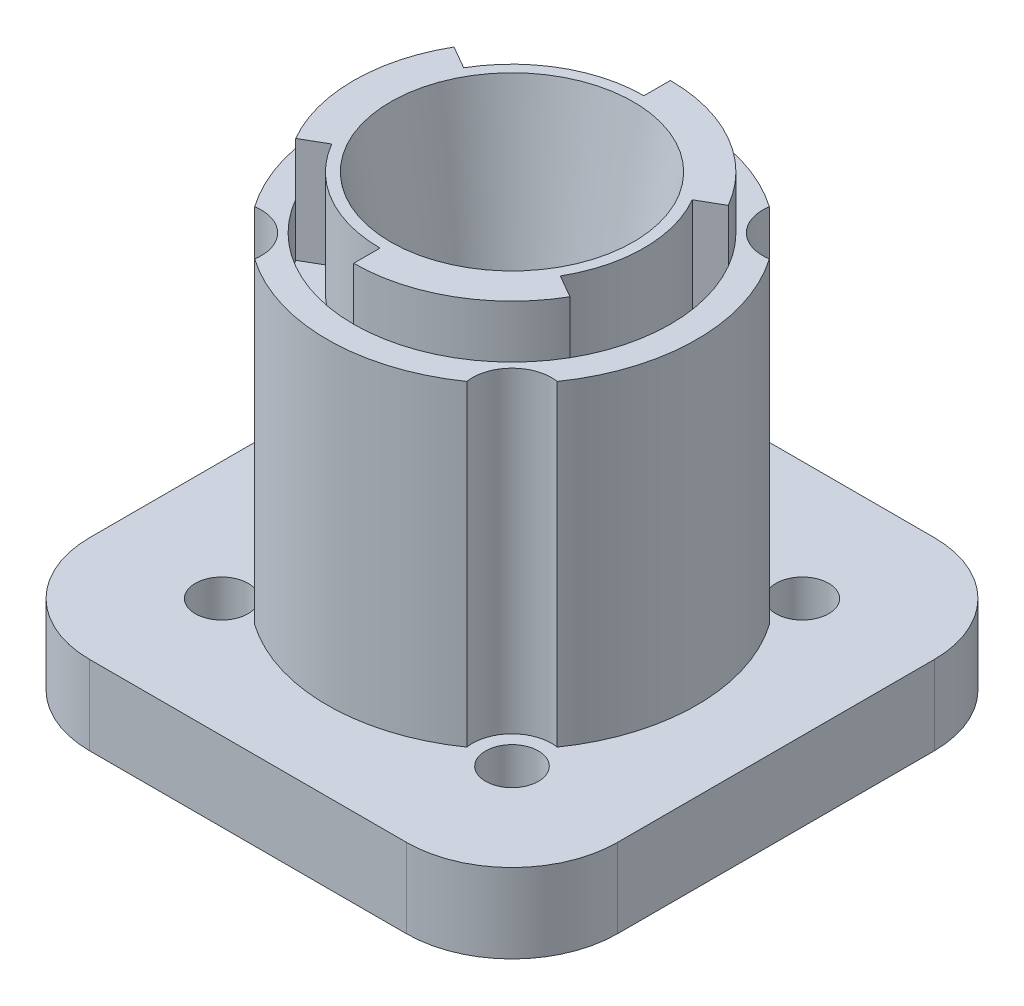
from build123d import *
from build123d.topology import SkipClean

# Parameters (mm, degrees)
CROQUIS1_W              = 50
CROQUIS1_H              = 50
SALIENTE_EXTRUIR1_DEPTH = 7.5
SKETCH4_R               = 12.5
BOSS_EXTRUDE2_DEPTH     = 30
CUT_EXTRUDE1_REACH      = 78.811
SKETCH6_R               = 3.75
SKETCH6_R_2             = 2.5
BOSS_EXTRUDE4_DEPTH     = 7.5
BOSS_EXTRUDE5_DEPTH     = 5
CUT_EXTRUDE3_START      = -5
CUT_EXTRUDE3_DEPTH      = 5
FILLET1_R               = 10
CUT_EXTRUDE4_REACH      = 80.899
SKETCH10_R              = 0.5


with BuildPart() as part:
    # Croquis1 → Saliente-Extruir1 (new body)
    with BuildSketch(Plane(origin=(0, 0, 0), x_dir=(1, 0, 0), z_dir=(0, 1, 0))):
        with Locations((-25, -25)):
            Rectangle(CROQUIS1_W, CROQUIS1_H)
    extrude(amount=SALIENTE_EXTRUIR1_DEPTH)

    # Sketch4 → Boss-Extrude2 (add)
    with BuildSketch(Plane(origin=(0, 7.5, 0), x_dir=(1, 0, 0), z_dir=(0, 1, 0))):
        with BuildLine():
            ThreePointArc((-39.329892063, -14.954892063), (-42.5, -25), (-39.329892063, -35.045107937))
            ThreePointArc((-39.329892063, -35.045107937), (-36.098349571, -36.098349571), (-35.045107937, -39.329892063))
            ThreePointArc((-35.045107937, -39.329892063), (-25, -42.5), (-14.954892063, -39.329892063))
            ThreePointArc((-14.954892063, -39.329892063), (-13.901650429, -36.098349571), (-10.670107937, -35.045107937))
            ThreePointArc((-10.670107937, -35.045107937), (-7.5, -25), (-10.670107937, -14.954892063))
            ThreePointArc((-10.670107937, -14.954892063), (-13.901650429, -13.901650429), (-14.954892063, -10.670107937))
            ThreePointArc((-14.954892063, -10.670107937), (-25, -7.5), (-35.045107937, -10.670107937))
            ThreePointArc((-35.045107937, -10.670107937), (-36.098349571, -13.901650429), (-39.329892063, -14.954892063))
        make_face()
        with Locations(Location((-25, -25, 0), (0, 0, 270))):
            Circle(SKETCH4_R, mode=Mode.SUBTRACT)
    extrude(amount=BOSS_EXTRUDE2_DEPTH)

    # Sketch5 → Cut-Extrude1 (cut, up to next)
    with BuildSketch(Plane(origin=(0, 7.5, 0), x_dir=(1, 0, 0), z_dir=(0, 1, 0)), mode=Mode.PRIVATE) as cut_extrude1_sk1:
        with BuildLine():
            ThreePointArc((-35.045107937, -10.670107937), (-41.401650429, -8.598349571), (-39.329892063, -14.954892063))
            ThreePointArc((-39.329892063, -14.954892063), (-36.311977772, -14.099306515), (-35, -11.25))
            ThreePointArc((-35, -11.25), (-35.011293992, -10.959178091), (-35.045107937, -10.670107937))
        make_face()
    cut_extrude1_tool1 = extrude(cut_extrude1_sk1.sketch, amount=-CUT_EXTRUDE1_REACH, mode=Mode.PRIVATE) & part.part
    # Sketch5 → Cut-Extrude1 (cut, up to next)
    with BuildSketch(Plane(origin=(0, 7.5, 0), x_dir=(1, 0, 0), z_dir=(0, 1, 0)), mode=Mode.PRIVATE) as cut_extrude1_sk2:
        with BuildLine():
            ThreePointArc((-7.5, -11.25), (-10.959178091, -7.511293992), (-14.954892063, -10.670107937))
            ThreePointArc((-14.954892063, -10.670107937), (-13.901650429, -13.901650429), (-10.670107937, -14.954892063))
            ThreePointArc((-10.670107937, -14.954892063), (-8.400693485, -13.688022228), (-7.5, -11.25))
        make_face()
    cut_extrude1_tool2 = extrude(cut_extrude1_sk2.sketch, amount=-CUT_EXTRUDE1_REACH, mode=Mode.PRIVATE) & part.part
    # Sketch5 → Cut-Extrude1 (cut, up to next)
    with BuildSketch(Plane(origin=(0, 7.5, 0), x_dir=(1, 0, 0), z_dir=(0, 1, 0)), mode=Mode.PRIVATE) as cut_extrude1_sk3:
        with BuildLine():
            ThreePointArc((-7.5, -38.75), (-8.400693485, -36.311977772), (-10.670107937, -35.045107937))
            ThreePointArc((-10.670107937, -35.045107937), (-13.901650429, -36.098349571), (-14.954892063, -39.329892063))
            ThreePointArc((-14.954892063, -39.329892063), (-10.959178091, -42.488706008), (-7.5, -38.75))
        make_face()
    cut_extrude1_tool3 = extrude(cut_extrude1_sk3.sketch, amount=-CUT_EXTRUDE1_REACH, mode=Mode.PRIVATE) & part.part
    # Sketch5 → Cut-Extrude1 (cut, up to next)
    with BuildSketch(Plane(origin=(0, 7.5, 0), x_dir=(1, 0, 0), z_dir=(0, 1, 0)), mode=Mode.PRIVATE) as cut_extrude1_sk4:
        with BuildLine():
            ThreePointArc((-39.329892063, -35.045107937), (-41.401650429, -41.401650429), (-35.045107937, -39.329892063))
            ThreePointArc((-35.045107937, -39.329892063), (-35.011293992, -39.040821909), (-35, -38.75))
            ThreePointArc((-35, -38.75), (-36.311977772, -35.900693485), (-39.329892063, -35.045107937))
        make_face()
    cut_extrude1_tool4 = extrude(cut_extrude1_sk4.sketch, amount=-CUT_EXTRUDE1_REACH, mode=Mode.PRIVATE) & part.part
    add(cut_extrude1_tool1.solids().sort_by_distance((-38.75, 7.5, 11.25))[0], mode=Mode.SUBTRACT)
    add(cut_extrude1_tool2.solids().sort_by_distance((-11.25, 7.5, 11.25))[0], mode=Mode.SUBTRACT)
    add(cut_extrude1_tool3.solids().sort_by_distance((-11.25, 7.5, 38.75))[0], mode=Mode.SUBTRACT)
    add(cut_extrude1_tool4.solids().sort_by_distance((-38.75, 7.5, 38.75))[0], mode=Mode.SUBTRACT)

    # Sketch6 → Boss-Extrude4 (add)
    # profile 1 of 4: a face of its own
    with BuildSketch(Plane.XZ):
        with Locations((-11.25, 38.75)):
            Circle(SKETCH6_R)
        with Locations(Location((-11.25, 38.75, 0), (0, 0, 90))):
            Circle(SKETCH6_R_2, mode=Mode.SUBTRACT)
    # profile 2 of 4: a face of its own
    with BuildSketch(Plane.XZ):
        with Locations((-38.75, 38.75)):
            Circle(SKETCH6_R)
        with Locations(Location((-38.75, 38.75, 0), (0, 0, 270))):
            Circle(SKETCH6_R_2, mode=Mode.SUBTRACT)
    # profile 3 of 4: a face of its own
    with BuildSketch(Plane.XZ):
        with Locations((-38.75, 11.25)):
            Circle(SKETCH6_R)
        with Locations(Location((-38.75, 11.25, 0), (0, 0, 270))):
            Circle(SKETCH6_R_2, mode=Mode.SUBTRACT)
    # profile 4 of 4: a face of its own
    with BuildSketch(Plane.XZ):
        with Locations((-11.25, 11.25)):
            Circle(SKETCH6_R)
        with Locations(Location((-11.25, 11.25, 0), (0, 0, 90))):
            Circle(SKETCH6_R_2, mode=Mode.SUBTRACT)
    extrude(amount=-BOSS_EXTRUDE4_DEPTH)

    # Sketch9 → Boss-Extrude5 (add)
    with BuildSketch(Plane(origin=(0, 37.5, 0), x_dir=(1, 0, 0), z_dir=(0, 1, 0))):
        with BuildLine():
            Line((-35.825317547, -18.75), (-37.990381057, -17.5))
            ThreePointArc((-37.990381057, -17.5), (-40, -25), (-37.990381057, -32.5))
            Line((-37.990381057, -32.5), (-35.825317547, -31.25))
            ThreePointArc((-35.825317547, -31.25), (-37.5, -25), (-35.825317547, -18.75))
        make_face()
        with BuildLine():
            Line((-25, -12.5), (-25, -10))
            ThreePointArc((-25, -10), (-17.5, -12.009618943), (-12.009618943, -17.5))
            Line((-12.009618943, -17.5), (-14.174682453, -18.75))
            ThreePointArc((-14.174682453, -18.75), (-18.75, -14.174682453), (-25, -12.5))
        make_face()
        with BuildLine():
            Line((-14.174682453, -31.25), (-12.009618943, -32.5))
            ThreePointArc((-12.009618943, -32.5), (-17.5, -37.990381057), (-25, -40))
            Line((-25, -40), (-25, -37.5))
            ThreePointArc((-25, -37.5), (-18.75, -35.825317547), (-14.174682453, -31.25))
        make_face()
    extrude(amount=BOSS_EXTRUDE5_DEPTH)

    # Sketch7 → Cut-Extrude3 (cut)
    with BuildSketch(Plane(origin=(0, 37.5, 0), x_dir=(1, 0, 0), z_dir=(0, 1, 0)).offset(CUT_EXTRUDE3_START)):
        with BuildLine():
            Line((-35.825317547, -18.75), (-37.990381057, -17.5))
            ThreePointArc((-37.990381057, -17.5), (-32.5, -12.009618943), (-25, -10))
            Line((-25, -10), (-25, -12.5))
            ThreePointArc((-25, -12.5), (-31.25, -14.174682453), (-35.825317547, -18.75))
        make_face()
        with BuildLine():
            Line((-14.174682453, -18.75), (-12.009618943, -17.5))
            ThreePointArc((-12.009618943, -17.5), (-10, -25), (-12.009618943, -32.5))
            Line((-12.009618943, -32.5), (-14.174682453, -31.25))
            ThreePointArc((-14.174682453, -31.25), (-12.5, -25), (-14.174682453, -18.75))
        make_face()
        with BuildLine():
            Line((-25, -37.5), (-25, -40))
            ThreePointArc((-25, -40), (-32.5, -37.990381057), (-37.990381057, -32.5))
            Line((-37.990381057, -32.5), (-35.825317547, -31.25))
            ThreePointArc((-35.825317547, -31.25), (-31.25, -35.825317547), (-25, -37.5))
        make_face()
    extrude(amount=CUT_EXTRUDE3_DEPTH, mode=Mode.SUBTRACT)

    # Fillet1
    fillet1_edges = [part.edges().sort_by_distance(p)[0] for p in [
        (0, 3.75, 50),
        (-50, 3.75, 50),
        (-50, 3.75, 0),
        (0, 3.75, 0),
    ]]
    fillet(fillet1_edges, radius=FILLET1_R)

    # Sketch10 → Cut-Extrude4 (cut, up to next)
    with BuildSketch(Plane(origin=(0, 7.5, 0), x_dir=(1, 0, 0), z_dir=(0, 1, 0)), mode=Mode.PRIVATE) as cut_extrude4_sk1:
        with Locations(Location((-25, -21.5, 0), (0, 0, 270))):
            Circle(SKETCH10_R)
    cut_extrude4_tool1 = extrude(cut_extrude4_sk1.sketch, amount=-CUT_EXTRUDE4_REACH, mode=Mode.PRIVATE) & part.part
    # Sketch10 → Cut-Extrude4 (cut, up to next)
    with BuildSketch(Plane(origin=(0, 7.5, 0), x_dir=(1, 0, 0), z_dir=(0, 1, 0)), mode=Mode.PRIVATE) as cut_extrude4_sk2:
        with Locations(Location((-25, -28.5, 0), (0, 0, 270))):
            Circle(SKETCH10_R)
    cut_extrude4_tool2 = extrude(cut_extrude4_sk2.sketch, amount=-CUT_EXTRUDE4_REACH, mode=Mode.PRIVATE) & part.part
    add(cut_extrude4_tool1.solids().sort_by_distance((-25, 7.5, 21.5))[0], mode=Mode.SUBTRACT)
    add(cut_extrude4_tool2.solids().sort_by_distance((-25, 7.5, 28.5))[0], mode=Mode.SUBTRACT)

    # Sketch12 → Revolve1 (revolve)
    with BuildSketch(Plane.ZY.offset(25)):
        Polygon((37.5, 42.5), (36.5, 42.5), (32.5, 17.5), (32.5, 7.5), (37.5, 7.5), align=None)
    revolve(axis=Axis((-25, 37.5, 25), (0, -1, 0)))


solid = part.part
